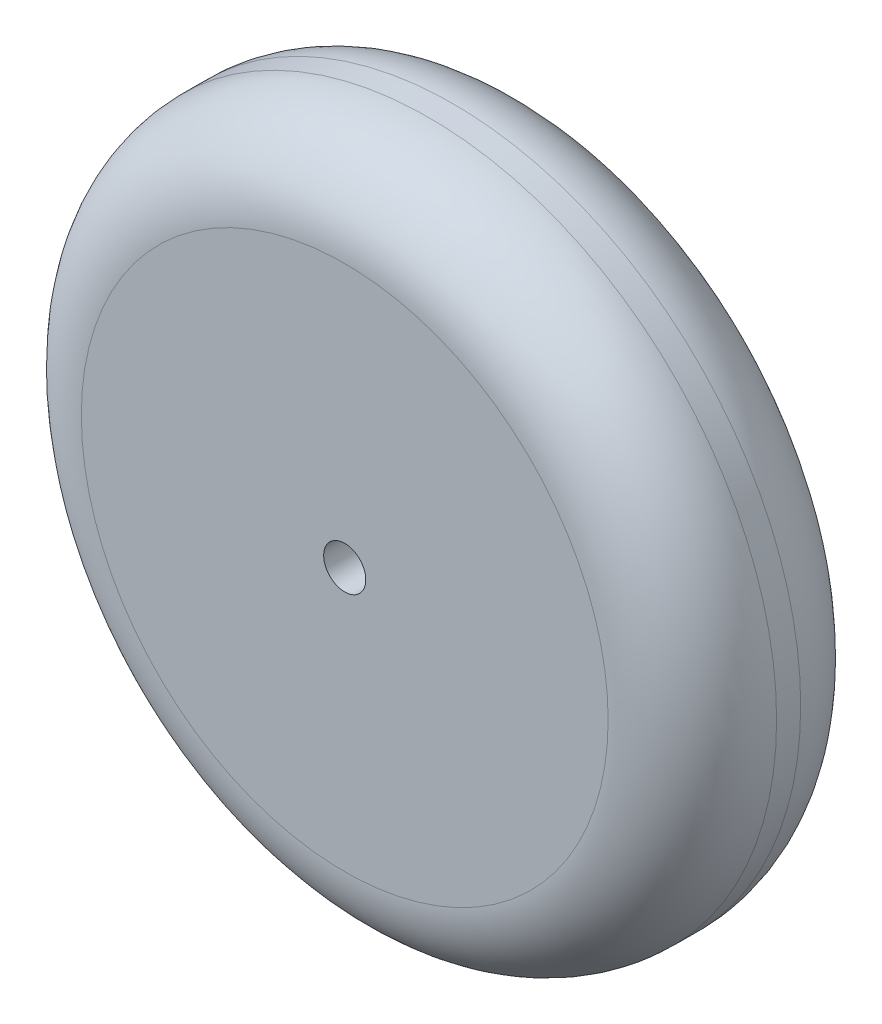
from build123d import *

# Parameters (mm, degrees)
SKETCH1_R           = 41.275
BOSS_EXTRUDE1_DEPTH = 22.86
CUT_EXTRUDE1_REACH  = 64.688
SKETCH2_R           = 2.5
FILLET2_R           = 10


with BuildPart() as part:
    # Sketch1 → Boss-Extrude1 (new body)
    with BuildSketch(Plane.XY):
        Circle(SKETCH1_R)
    extrude(amount=BOSS_EXTRUDE1_DEPTH)

    # Sketch2 → Cut-Extrude1 (cut, up to next)
    with BuildSketch(Plane.XY, mode=Mode.PRIVATE) as cut_extrude1_sk1:
        with Locations(Location((0, 0, 0), (0, 0, 180))):
            Circle(SKETCH2_R)
    cut_extrude1_tool1 = extrude(cut_extrude1_sk1.sketch, amount=CUT_EXTRUDE1_REACH, mode=Mode.PRIVATE) & part.part
    add(cut_extrude1_tool1.solids().sort_by_distance((0, 0, 0))[0], mode=Mode.SUBTRACT)

    # Fillet2
    fillet2_edges = [part.edges().sort_by_distance(p)[0] for p in [
        (-41.275, 0, 0),
        (-41.275, 0, 22.86),
    ]]
    fillet(fillet2_edges, radius=FILLET2_R)


solid = part.part
